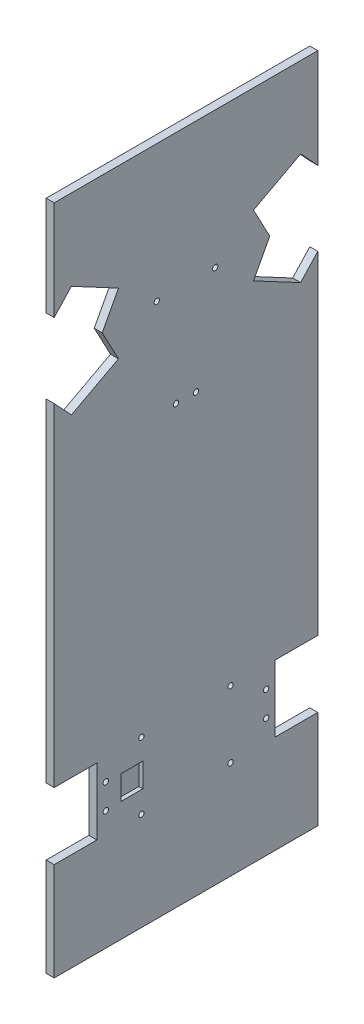
from build123d import *

# Parameters (mm, degrees)
SKETCH_1_W           = 98.8
SKETCH_1_H           = 251.6
EXTRUDE_1_DEPTH      = 3
SKETCH_2_W           = 16
SKETCH_2_H           = 25
CUT_EXTRUDE_1_DEPTH  = 271.320180527
CUT_EXTRUDE_2_DEPTH  = 271.320180527
SKETCH_5_R           = 1
CUT_EXTRUDE_3_DEPTH  = 271.320180527
SKETCH_5_3_R         = 1.5
SKETCH_5_3_R_2       = 1
CUT_EXTRUDE_4_DEPTH  = 1.5
SKETCH_6_R           = 1.5
SKETCH_6_R_2         = 1
CUT_EXTRUDE_7_DEPTH  = 1.5
SKETCH_6_2_R         = 1
CUT_EXTRUDE_8_DEPTH  = 271.320180527
SKETCH_7_W           = 8.2
SKETCH_7_H           = 9
CUT_EXTRUDE_9_DEPTH  = 1.5
SKETCH_8_R           = 1
CUT_EXTRUDE_10_DEPTH = 271.320180527
SKETCH_8_3_R         = 1.5
SKETCH_8_3_R_2       = 1
CUT_EXTRUDE_11_DEPTH = 1.5
SKETCH_9_R           = 1
CUT_EXTRUDE_12_DEPTH = 271.320180527
SKETCH_9_3_R         = 1.5
SKETCH_9_3_R_2       = 1
CUT_EXTRUDE_13_DEPTH = 1.5


with BuildPart() as part:
    # 草图1 → 凸台-拉伸1 (new body)
    with BuildSketch(Plane(origin=(0, 0, 0), x_dir=(0, 0, -1), z_dir=(1, 0, 0))):
        with Locations((49.4, -125.8)):
            Rectangle(SKETCH_1_W, SKETCH_1_H)
    extrude(amount=EXTRUDE_1_DEPTH)

    # 草图2 → 切除-拉伸1 (cut, through all)
    with BuildSketch(Plane(origin=(3, 0, 0), x_dir=(0, 0, -1), z_dir=(1, 0, 0))):
        with Locations((8, -51.2)):
            Rectangle(SKETCH_2_W, SKETCH_2_H)
        with Locations((90.8, -51.2)):
            Rectangle(SKETCH_2_W, SKETCH_2_H)
        with Locations((8, -202.3)):
            Rectangle(SKETCH_2_W, SKETCH_2_H)
        with Locations((90.8, -202.3)):
            Rectangle(SKETCH_2_W, SKETCH_2_H)
    extrude(amount=-CUT_EXTRUDE_1_DEPTH, mode=Mode.SUBTRACT)

    # 草图4 → 切除-拉伸2 (cut, through all)
    with BuildSketch(Plane(origin=(3, 0, 0), x_dir=(0, 0, -1), z_dir=(1, 0, 0))):
        Polygon((24.103130316, -62.678318707), (18, -51.2), (24.103130316, -39.721681293), (6.444178459, -30.332250037), (0, -37.242785378), (0, -38.7), (16, -38.7), (16, -63.7), (0, -63.7), (0, -65.157214622), (6.444178459, -72.067749963), align=None)
        Polygon((74.696869684, -39.721681293), (80.8, -51.2), (74.696869684, -62.678318707), (92.355821541, -72.067749963), (98.8, -65.157214622), (98.8, -63.7), (82.8, -63.7), (82.8, -38.7), (98.8, -38.7), (98.8, -37.242785378), (92.355821541, -30.332250037), align=None)
    extrude(amount=-CUT_EXTRUDE_2_DEPTH, mode=Mode.SUBTRACT)

    # 草图5 → 切除-拉伸3 (cut, through all)
    with BuildSketch(Plane.ZY):
        with Locations((-38.45, -51.2)):
            Circle(SKETCH_5_R)
        with Locations((-60.35, -51.2)):
            Circle(SKETCH_5_R)
    extrude(amount=-CUT_EXTRUDE_3_DEPTH, mode=Mode.SUBTRACT)

    # 草图5<3> → 切除-拉伸4 (cut)
    # profile 1 of 2: a face of its own
    with BuildSketch(Plane.ZY):
        with Locations((-38.45, -51.2)):
            Circle(SKETCH_5_3_R)
        with Locations((-38.45, -51.2)):
            Circle(SKETCH_5_3_R_2, mode=Mode.SUBTRACT)
    # profile 2 of 2: a face of its own
    with BuildSketch(Plane.ZY):
        with Locations((-60.35, -51.2)):
            Circle(SKETCH_5_3_R)
        with Locations((-60.35, -51.2)):
            Circle(SKETCH_5_3_R_2, mode=Mode.SUBTRACT)
    extrude(amount=-CUT_EXTRUDE_4_DEPTH, mode=Mode.SUBTRACT)

    # 草图6 → 切除-拉伸7 (cut)
    # profile 1 of 2: a face of its own
    with BuildSketch(Plane.ZY):
        with Locations((-45.65, -88)):
            Circle(SKETCH_6_R)
        with Locations((-45.65, -88)):
            Circle(SKETCH_6_R_2, mode=Mode.SUBTRACT)
    # profile 2 of 2: a face of its own
    with BuildSketch(Plane.ZY):
        with Locations((-53.15, -88)):
            Circle(SKETCH_6_R)
        with Locations((-53.15, -88)):
            Circle(SKETCH_6_R_2, mode=Mode.SUBTRACT)
    extrude(amount=-CUT_EXTRUDE_7_DEPTH, mode=Mode.SUBTRACT)

    # 草图6<2> → 切除-拉伸8 (cut, through all)
    with BuildSketch(Plane.ZY):
        with Locations((-45.65, -88)):
            Circle(SKETCH_6_2_R)
        with Locations((-53.15, -88)):
            Circle(SKETCH_6_2_R)
    extrude(amount=-CUT_EXTRUDE_8_DEPTH, mode=Mode.SUBTRACT)

    # 草图7 → 切除-拉伸9 (cut)
    with BuildSketch(Plane(origin=(3, 0, 0), x_dir=(0, 0, -1), z_dir=(1, 0, 0))):
        with Locations((29.1, -202.3)):
            Rectangle(SKETCH_7_W, SKETCH_7_H)
    extrude(amount=-CUT_EXTRUDE_9_DEPTH, mode=Mode.SUBTRACT)

    # 草图8 → 切除-拉伸10 (cut, through all)
    with BuildSketch(Plane.ZY):
        with Locations((-79.45, -197.6)):
            Circle(SKETCH_8_R)
        with Locations((-79.45, -207)):
            Circle(SKETCH_8_R)
        with Locations((-19.35, -207)):
            Circle(SKETCH_8_R)
        with Locations((-19.35, -197.6)):
            Circle(SKETCH_8_R)
    extrude(amount=-CUT_EXTRUDE_10_DEPTH, mode=Mode.SUBTRACT)

    # 草图8<3> → 切除-拉伸11 (cut)
    # profile 1 of 4: a face of its own
    with BuildSketch(Plane.ZY):
        with Locations((-79.45, -197.6)):
            Circle(SKETCH_8_3_R)
        with Locations((-79.45, -197.6)):
            Circle(SKETCH_8_3_R_2, mode=Mode.SUBTRACT)
    # profile 2 of 4: a face of its own
    with BuildSketch(Plane.ZY):
        with Locations((-79.45, -207)):
            Circle(SKETCH_8_3_R)
        with Locations((-79.45, -207)):
            Circle(SKETCH_8_3_R_2, mode=Mode.SUBTRACT)
    # profile 3 of 4: a face of its own
    with BuildSketch(Plane.ZY):
        with Locations((-19.35, -207)):
            Circle(SKETCH_8_3_R)
        with Locations((-19.35, -207)):
            Circle(SKETCH_8_3_R_2, mode=Mode.SUBTRACT)
    # profile 4 of 4: a face of its own
    with BuildSketch(Plane.ZY):
        with Locations((-19.35, -197.6)):
            Circle(SKETCH_8_3_R)
        with Locations((-19.35, -197.6)):
            Circle(SKETCH_8_3_R_2, mode=Mode.SUBTRACT)
    extrude(amount=-CUT_EXTRUDE_11_DEPTH, mode=Mode.SUBTRACT)

    # 草图9 → 切除-拉伸12 (cut, through all)
    with BuildSketch(Plane.ZY):
        with Locations((-66.1, -189.8)):
            Circle(SKETCH_9_R)
        with Locations((-32.7, -189.8)):
            Circle(SKETCH_9_R)
        with Locations((-66.1, -214.8)):
            Circle(SKETCH_9_R)
        with Locations((-32.7, -214.8)):
            Circle(SKETCH_9_R)
    extrude(amount=-CUT_EXTRUDE_12_DEPTH, mode=Mode.SUBTRACT)

    # 草图9<3> → 切除-拉伸13 (cut)
    # profile 1 of 4: a face of its own
    with BuildSketch(Plane.ZY):
        with Locations((-66.1, -189.8)):
            Circle(SKETCH_9_3_R)
        with Locations((-66.1, -189.8)):
            Circle(SKETCH_9_3_R_2, mode=Mode.SUBTRACT)
    # profile 2 of 4: a face of its own
    with BuildSketch(Plane.ZY):
        with Locations((-32.7, -189.8)):
            Circle(SKETCH_9_3_R)
        with Locations((-32.7, -189.8)):
            Circle(SKETCH_9_3_R_2, mode=Mode.SUBTRACT)
    # profile 3 of 4: a face of its own
    with BuildSketch(Plane.ZY):
        with Locations((-66.1, -214.8)):
            Circle(SKETCH_9_3_R)
        with Locations((-66.1, -214.8)):
            Circle(SKETCH_9_3_R_2, mode=Mode.SUBTRACT)
    # profile 4 of 4: a face of its own
    with BuildSketch(Plane.ZY):
        with Locations((-32.7, -214.8)):
            Circle(SKETCH_9_3_R)
        with Locations((-32.7, -214.8)):
            Circle(SKETCH_9_3_R_2, mode=Mode.SUBTRACT)
    extrude(amount=-CUT_EXTRUDE_13_DEPTH, mode=Mode.SUBTRACT)


solid = part.part
